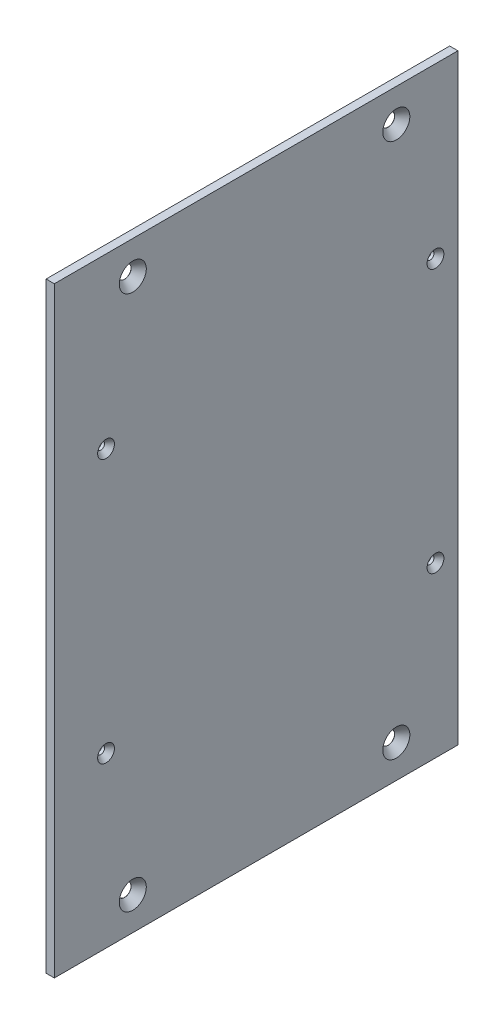
from build123d import *

# Parameters (mm, degrees)
SKETCH1_W                       = 231.775000504
SKETCH1_H                       = 155.575
BOSS_EXTRUDE1_DEPTH             = 3.175
F_10_CLEARANCE_HOLE1_AT_2_COUNT = 2
F_10_CLEARANCE_HOLE1_AT_2_PITCH = 101.6
F_10_CLEARANCE_HOLE1_AT_3_COUNT = 2
F_10_CLEARANCE_HOLE1_AT_3_PITCH = 230.028695701
F_10_CLEARANCE_HOLE1_AT_4_COUNT = 2
F_10_CLEARANCE_HOLE1_AT_4_PITCH = 206.375000535
F_4_CLEARANCE_HOLE1_AT_2_COUNT  = 2
F_4_CLEARANCE_HOLE1_AT_2_PITCH  = 101.6
F_4_CLEARANCE_HOLE1_AT_3_COUNT  = 2
F_4_CLEARANCE_HOLE1_AT_3_PITCH  = 162.639355631
F_4_CLEARANCE_HOLE1_AT_4_COUNT  = 2
F_4_CLEARANCE_HOLE1_AT_4_PITCH  = 127


with BuildPart() as part:
    # Sketch1 → Boss-Extrude1 (new body)
    with BuildSketch(Plane.YZ.offset(19.05)):
        with Locations((-91.578028487, 103.052517839)):
            Rectangle(SKETCH1_W, SKETCH1_H)
    extrude(amount=BOSS_EXTRUDE1_DEPTH)

    # Sketch5 → #10 Clearance Hole1 (revolve, cut)
    with BuildSketch(Plane(origin=(19.05, -194.76552877, 150.600645729), x_dir=(0, 0, 1), z_dir=(0, 1, 0))):
        Polygon((0, 0), (0, 3.175), (5.207, 3.175), (2.4892, 0.048528743), (2.4892, 0), align=None)
    f_10_clearance_hole1 = revolve(axis=Axis((12.7, -194.76552877, 150.600645729), (1, 0, 0)), mode=Mode.SUBTRACT)

    # #10 Clearance Hole1 at 2: #10 Clearance Hole1 ×2
    with Locations(*[(0, 0, -i * F_10_CLEARANCE_HOLE1_AT_2_PITCH) for i in range(1, F_10_CLEARANCE_HOLE1_AT_2_COUNT)]):
        add(f_10_clearance_hole1, mode=Mode.SUBTRACT)

    # #10 Clearance Hole1 at 3: #10 Clearance Hole1 ×2
    with Locations(*[Vector(0, 0.8971706764945216, -0.44168402420549757) * (i * F_10_CLEARANCE_HOLE1_AT_3_PITCH) for i in range(1, F_10_CLEARANCE_HOLE1_AT_3_COUNT)]):
        add(f_10_clearance_hole1, mode=Mode.SUBTRACT)

    # #10 Clearance Hole1 at 4: #10 Clearance Hole1 ×2
    with Locations(*[(0, i * F_10_CLEARANCE_HOLE1_AT_4_PITCH, 0) for i in range(1, F_10_CLEARANCE_HOLE1_AT_4_COUNT)]):
        add(f_10_clearance_hole1, mode=Mode.SUBTRACT)

    # Sketch11 → #4 Clearance Hole1 (revolve, cut)
    with BuildSketch(Plane(origin=(22.225, -40.778028487, 160.910543982), x_dir=(0, 0, -1), z_dir=(0, 1, 0))):
        Polygon((0, 0), (0, 3.175), (1.4732, 3.175), (1.4732, 2.030745349), (3.2385, 0), align=None)
    f_4_clearance_hole1 = revolve(axis=Axis((28.575, -40.778028487, 160.910543982), (-1, 0, 0)), mode=Mode.SUBTRACT)

    # #4 Clearance Hole1 at 2: #4 Clearance Hole1 ×2
    with Locations(*[(0, -i * F_4_CLEARANCE_HOLE1_AT_2_PITCH, 0) for i in range(1, F_4_CLEARANCE_HOLE1_AT_2_COUNT)]):
        add(f_4_clearance_hole1, mode=Mode.SUBTRACT)

    # #4 Clearance Hole1 at 3: #4 Clearance Hole1 ×2
    with Locations(*[Vector(0, -0.6246950475544236, -0.7808688094430308) * (i * F_4_CLEARANCE_HOLE1_AT_3_PITCH) for i in range(1, F_4_CLEARANCE_HOLE1_AT_3_COUNT)]):
        add(f_4_clearance_hole1, mode=Mode.SUBTRACT)

    # #4 Clearance Hole1 at 4: #4 Clearance Hole1 ×2
    with Locations(*[(0, 0, -i * F_4_CLEARANCE_HOLE1_AT_4_PITCH) for i in range(1, F_4_CLEARANCE_HOLE1_AT_4_COUNT)]):
        add(f_4_clearance_hole1, mode=Mode.SUBTRACT)


solid = part.part
